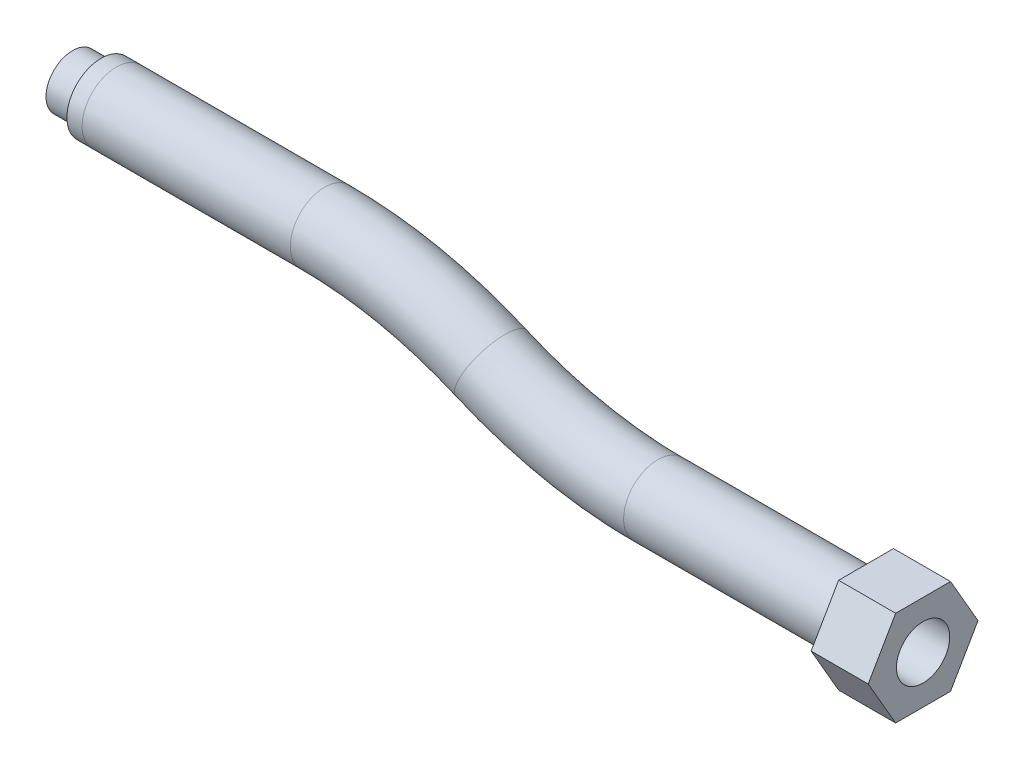
from build123d import *
from build123d.topology import SkipClean

# Parameters (mm, degrees)
SWEEP_THIN1_PROFILE_R   = 11.43
SWEEP_THIN1_PROFILE_R_2 = 6.35
SKETCH9_R               = 8.89
BOSS_EXTRUDE1_DEPTH     = 19.05
SKETCH10_R              = 8.89
SKETCH10_R_2            = 6.35
BOSS_EXTRUDE2_DEPTH     = 9.525


with BuildPart() as part:
    # Sweep-Thin1: sweep along a curve in space
    with BuildLine() as sweep_thin1_path:
        Line((-69.510499667, 0, 0), (0, 0, 0))
        ThreePointArc((-125.147371892, 11.557, 0), (-97.922758465, 2.919761844, 0), (-69.510499667, 0, 0))
        ThreePointArc((-180.784244117, 23.114, 0), (-152.371985319, 20.194238156, 0), (-125.147371892, 11.557, 0))
        Line((-250.294743784, 23.114, 0), (-180.784244117, 23.114, 0))
        Line((-250.294743784, 23.114, 0), (-255.374743784, 23.114, 0))
    # Sweep-Thin1 profile (on start of the path) → Sweep-Thin1 (sweep)
    with BuildSketch(Plane(origin=(-255.374743784, 23.114, 0), x_dir=(0, 0, 1), z_dir=(1, 0, 0))):
        Circle(SWEEP_THIN1_PROFILE_R)
        Circle(SWEEP_THIN1_PROFILE_R_2, mode=Mode.SUBTRACT)
    sweep(path=sweep_thin1_path.line)

    # Sketch9 → Boss-Extrude1 (add)
    with BuildSketch(Plane(origin=(0, 0, 0), x_dir=(0, 0, -1), z_dir=(1, 0, 0))):
        Polygon((9.165435523, 15.875), (-9.165435523, 15.875), (-18.330871047, 0), (-9.165435523, -15.875), (9.165435523, -15.875), (18.330871047, 0), align=None)
        with Locations(Location((0, 0, 0), (0, 0, 270))):
            Circle(SKETCH9_R, mode=Mode.SUBTRACT)
    extrude(amount=BOSS_EXTRUDE1_DEPTH)

    # Sketch10 → Boss-Extrude2 (add)
    with SkipClean():  # the faces are left unmerged after this step: merging them gives an invalid solid
        with BuildSketch(Plane.ZY.offset(255.374743784)):
            with Locations(Location((0, 23.114, 0), (0, 0, 90))):
                Circle(SKETCH10_R)
            with Locations(Location((0, 23.114, 0), (0, 0, 270))):
                Circle(SKETCH10_R_2, mode=Mode.SUBTRACT)
        extrude(amount=BOSS_EXTRUDE2_DEPTH)


solid = part.part
